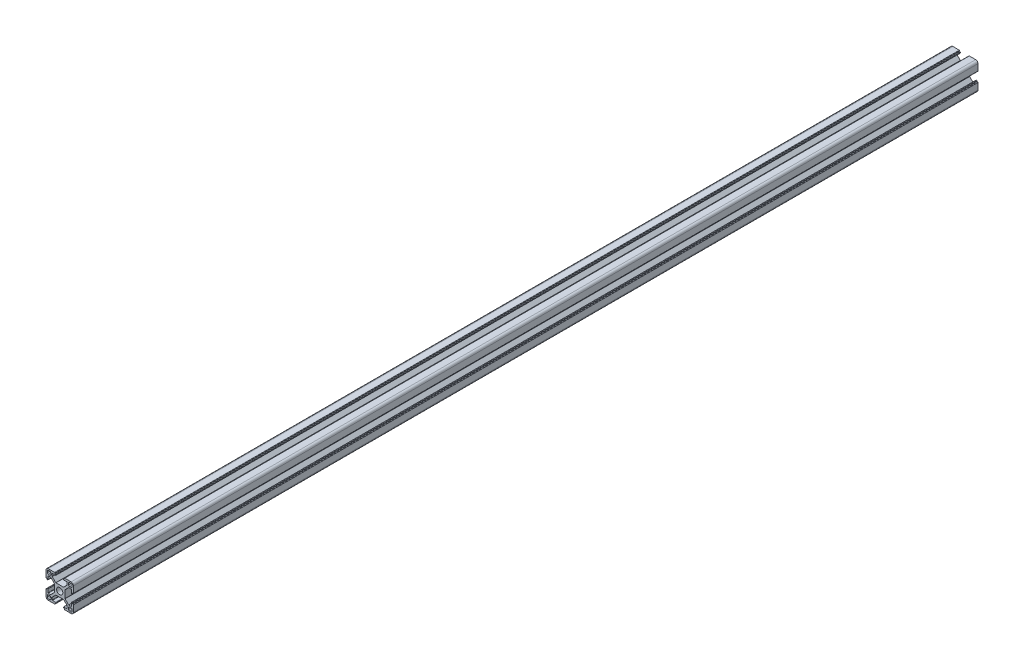
from build123d import *

# Parameters (mm, degrees)
MODEL_R             = 6.8
BOSS_EXTRUDE1_DEPTH = 1980
SCALE1_SCALE        = 0.333333333


with BuildPart() as part:
    # Model → Boss-Extrude1 (new body)
    with BuildSketch(Plane.XY):
        with BuildLine():
            Line((0, 11.6), (-8.240202025, 11.6))
            ThreePointArc((-8.240202025, 11.6), (-8.469812085, 11.64567228), (-8.664466094, 11.775735931))
            Line((-8.664466094, 11.775735931), (-16.324264069, 19.435533906))
            ThreePointArc((-16.324264069, 19.435533906), (-16.45432772, 19.630187915), (-16.5, 19.859797975))
            Line((-16.5, 19.859797975), (-16.5, 25))
            ThreePointArc((-16.5, 25), (-16.324264069, 25.424264069), (-15.9, 25.6))
            Line((-15.9, 25.6), (-8.8, 25.6))
            ThreePointArc((-8.8, 25.6), (-8.375735931, 25.775735931), (-8.2, 26.2))
            Line((-8.2, 26.2), (-8.2, 27.4))
            ThreePointArc((-8.2, 27.4), (-8.375735931, 27.824264069), (-8.8, 28))
            Line((-8.8, 28), (-9.8, 28))
            ThreePointArc((-9.8, 28), (-10.224264069, 28.175735931), (-10.4, 28.6))
            Line((-10.4, 28.6), (-10.4, 29.4))
            ThreePointArc((-10.4, 29.4), (-10.575735931, 29.824264069), (-10.999999999, 30))
            Line((-10.999999999, 30), (-25, 30))
            ThreePointArc((-25, 30), (-28.535533906, 28.535533906), (-30, 25))
            Line((-30, 25), (-30, 11))
            ThreePointArc((-30, 11), (-29.824264069, 10.575735931), (-29.4, 10.4))
            Line((-29.4, 10.4), (-28.6, 10.4))
            ThreePointArc((-28.6, 10.4), (-28.175735931, 10.224264069), (-28, 9.8))
            Line((-28, 9.8), (-28, 8.8))
            ThreePointArc((-28, 8.8), (-27.824264069, 8.375735931), (-27.4, 8.2))
            Line((-27.4, 8.2), (-26.2, 8.2))
            ThreePointArc((-26.2, 8.2), (-25.775735931, 8.375735931), (-25.6, 8.8))
            Line((-25.6, 8.8), (-25.6, 15.9))
            ThreePointArc((-25.6, 15.9), (-25.424264069, 16.324264069), (-25, 16.5))
            Line((-25, 16.5), (-19.859797974, 16.5))
            ThreePointArc((-19.859797974, 16.5), (-19.630187915, 16.454327719), (-19.435533906, 16.324264068))
            Line((-19.435533906, 16.324264068), (-11.775735931, 8.664466094))
            ThreePointArc((-11.775735931, 8.664466094), (-11.64567228, 8.469812085), (-11.6, 8.240202025))
            Line((-11.6, 8.240202025), (-11.6, 0))
            Line((-11.6, 0), (-11.6, -8.240202025))
            ThreePointArc((-11.6, -8.240202025), (-11.64567228, -8.469812085), (-11.775735931, -8.664466094))
            Line((-11.775735931, -8.664466094), (-19.435533906, -16.324264068))
            ThreePointArc((-19.435533906, -16.324264068), (-19.630187915, -16.454327719), (-19.859797974, -16.5))
            Line((-19.859797974, -16.5), (-25, -16.5))
            ThreePointArc((-25, -16.5), (-25.424264069, -16.324264069), (-25.6, -15.9))
            Line((-25.6, -15.9), (-25.6, -8.8))
            ThreePointArc((-25.6, -8.8), (-25.775735931, -8.375735931), (-26.2, -8.2))
            Line((-26.2, -8.2), (-27.4, -8.2))
            ThreePointArc((-27.4, -8.2), (-27.824264069, -8.375735931), (-28, -8.8))
            Line((-28, -8.8), (-28, -9.8))
            ThreePointArc((-28, -9.8), (-28.175735931, -10.224264069), (-28.6, -10.4))
            Line((-28.6, -10.4), (-29.4, -10.4))
            ThreePointArc((-29.4, -10.4), (-29.824264069, -10.575735931), (-30, -11))
            Line((-30, -11), (-30, -25))
            ThreePointArc((-30, -25), (-28.535533906, -28.535533906), (-25, -30))
            Line((-25, -30), (-10.999999999, -30))
            ThreePointArc((-10.999999999, -30), (-10.575735931, -29.824264069), (-10.4, -29.4))
            Line((-10.4, -29.4), (-10.4, -28.6))
            ThreePointArc((-10.4, -28.6), (-10.224264069, -28.175735931), (-9.8, -28))
            Line((-9.8, -28), (-8.8, -28))
            ThreePointArc((-8.8, -28), (-8.375735931, -27.824264069), (-8.2, -27.4))
            Line((-8.2, -27.4), (-8.2, -26.2))
            ThreePointArc((-8.2, -26.2), (-8.375735931, -25.775735931), (-8.8, -25.6))
            Line((-8.8, -25.6), (-15.9, -25.6))
            ThreePointArc((-15.9, -25.6), (-16.324264069, -25.424264069), (-16.5, -25))
            Line((-16.5, -25), (-16.5, -19.859797975))
            ThreePointArc((-16.5, -19.859797975), (-16.45432772, -19.630187915), (-16.324264069, -19.435533906))
            Line((-16.324264069, -19.435533906), (-8.664466094, -11.775735931))
            ThreePointArc((-8.664466094, -11.775735931), (-8.469812085, -11.64567228), (-8.240202025, -11.6))
            Line((-8.240202025, -11.6), (0, -11.6))
            Line((0, -11.6), (8.240202025, -11.6))
            ThreePointArc((8.240202025, -11.6), (8.469812085, -11.64567228), (8.664466094, -11.775735931))
            Line((8.664466094, -11.775735931), (16.324264069, -19.435533906))
            ThreePointArc((16.324264069, -19.435533906), (16.45432772, -19.630187915), (16.5, -19.859797975))
            Line((16.5, -19.859797975), (16.5, -25))
            ThreePointArc((16.5, -25), (16.324264069, -25.424264069), (15.9, -25.6))
            Line((15.9, -25.6), (8.8, -25.6))
            ThreePointArc((8.8, -25.6), (8.375735931, -25.775735931), (8.2, -26.2))
            Line((8.2, -26.2), (8.2, -27.4))
            ThreePointArc((8.2, -27.4), (8.375735931, -27.824264069), (8.8, -28))
            Line((8.8, -28), (9.8, -28))
            ThreePointArc((9.8, -28), (10.224264069, -28.175735931), (10.4, -28.6))
            Line((10.4, -28.6), (10.4, -29.4))
            ThreePointArc((10.4, -29.4), (10.575735931, -29.824264069), (10.999999999, -30))
            Line((10.999999999, -30), (25, -30))
            ThreePointArc((25, -30), (28.535533906, -28.535533906), (30, -25))
            Line((30, -25), (30, -11))
            ThreePointArc((30, -11), (29.824264069, -10.575735931), (29.4, -10.4))
            Line((29.4, -10.4), (28.6, -10.4))
            ThreePointArc((28.6, -10.4), (28.175735931, -10.224264069), (28, -9.8))
            Line((28, -9.8), (28, -8.8))
            ThreePointArc((28, -8.8), (27.824264069, -8.375735931), (27.4, -8.2))
            Line((27.4, -8.2), (26.2, -8.2))
            ThreePointArc((26.2, -8.2), (25.775735931, -8.375735931), (25.6, -8.8))
            Line((25.6, -8.8), (25.6, -15.9))
            ThreePointArc((25.6, -15.9), (25.424264069, -16.324264069), (25, -16.5))
            Line((25, -16.5), (19.859797974, -16.5))
            ThreePointArc((19.859797974, -16.5), (19.630187915, -16.454327719), (19.435533906, -16.324264068))
            Line((19.435533906, -16.324264068), (11.775735931, -8.664466094))
            ThreePointArc((11.775735931, -8.664466094), (11.64567228, -8.469812085), (11.6, -8.240202025))
            Line((11.6, -8.240202025), (11.6, 0))
            Line((11.6, 0), (11.6, 8.240202025))
            ThreePointArc((11.6, 8.240202025), (11.64567228, 8.469812085), (11.775735931, 8.664466094))
            Line((11.775735931, 8.664466094), (19.611269837, 16.5))
            Line((19.611269837, 16.5), (25, 16.5))
            ThreePointArc((25, 16.5), (25.424264069, 16.324264069), (25.6, 15.9))
            Line((25.6, 15.9), (25.6, 8.8))
            ThreePointArc((25.6, 8.8), (25.775735931, 8.375735931), (26.2, 8.2))
            Line((26.2, 8.2), (27.4, 8.2))
            ThreePointArc((27.4, 8.2), (27.824264069, 8.375735931), (28, 8.8))
            Line((28, 8.8), (28, 9.8))
            ThreePointArc((28, 9.8), (28.175735931, 10.224264069), (28.6, 10.4))
            Line((28.6, 10.4), (29.4, 10.4))
            ThreePointArc((29.4, 10.4), (29.824264069, 10.575735931), (30, 11))
            Line((30, 11), (30, 25))
            ThreePointArc((30, 25), (28.535533906, 28.535533906), (25, 30))
            Line((25, 30), (10.999999999, 30))
            ThreePointArc((10.999999999, 30), (10.575735931, 29.824264069), (10.4, 29.4))
            Line((10.4, 29.4), (10.4, 28.6))
            ThreePointArc((10.4, 28.6), (10.224264069, 28.175735931), (9.8, 28))
            Line((9.8, 28), (8.8, 28))
            ThreePointArc((8.8, 28), (8.375735931, 27.824264069), (8.2, 27.4))
            Line((8.2, 27.4), (8.2, 26.2))
            ThreePointArc((8.2, 26.2), (8.375735931, 25.775735931), (8.8, 25.6))
            Line((8.8, 25.6), (15.9, 25.6))
            ThreePointArc((15.9, 25.6), (16.324264069, 25.424264069), (16.5, 25))
            Line((16.5, 25), (16.5, 19.859797975))
            ThreePointArc((16.5, 19.859797975), (16.45432772, 19.630187915), (16.324264069, 19.435533906))
            Line((16.324264069, 19.435533906), (8.664466094, 11.775735931))
            ThreePointArc((8.664466094, 11.775735931), (8.469812085, 11.64567228), (8.240202025, 11.6))
            Line((8.240202025, 11.6), (0, 11.6))
        make_face()
        Circle(MODEL_R, mode=Mode.SUBTRACT)
        with BuildLine():
            Line((21.5, 27), (25, 27))
            ThreePointArc((25, 27), (26.414213562, 26.414213562), (27, 25))
            Line((27, 25), (27, 21.5))
            ThreePointArc((27, 21.5), (26.414213562, 20.085786438), (25, 19.5))
            Line((25, 19.5), (21.5, 19.5))
            ThreePointArc((21.5, 19.5), (20.085786438, 20.085786438), (19.5, 21.5))
            Line((19.5, 21.5), (19.5, 25))
            ThreePointArc((19.5, 25), (20.085786438, 26.414213562), (21.5, 27))
        make_face(mode=Mode.SUBTRACT)
        with BuildLine():
            Line((21.5, -27), (25, -27))
            ThreePointArc((25, -27), (26.414213562, -26.414213562), (27, -25))
            Line((27, -25), (27, -21.5))
            ThreePointArc((27, -21.5), (26.414213562, -20.085786438), (25, -19.5))
            Line((25, -19.5), (21.5, -19.5))
            ThreePointArc((21.5, -19.5), (20.085786438, -20.085786438), (19.5, -21.5))
            Line((19.5, -21.5), (19.5, -25))
            ThreePointArc((19.5, -25), (20.085786438, -26.414213562), (21.5, -27))
        make_face(mode=Mode.SUBTRACT)
        with BuildLine():
            Line((-21.5, -27), (-25, -27))
            ThreePointArc((-25, -27), (-26.414213562, -26.414213562), (-27, -25))
            Line((-27, -25), (-27, -21.5))
            ThreePointArc((-27, -21.5), (-26.414213562, -20.085786438), (-25, -19.5))
            Line((-25, -19.5), (-21.5, -19.5))
            ThreePointArc((-21.5, -19.5), (-20.085786438, -20.085786438), (-19.5, -21.5))
            Line((-19.5, -21.5), (-19.5, -25))
            ThreePointArc((-19.5, -25), (-20.085786438, -26.414213562), (-21.5, -27))
        make_face(mode=Mode.SUBTRACT)
        with BuildLine():
            Line((-21.5, 27), (-25, 27))
            ThreePointArc((-25, 27), (-26.414213562, 26.414213562), (-27, 25))
            Line((-27, 25), (-27, 21.5))
            ThreePointArc((-27, 21.5), (-26.414213562, 20.085786438), (-25, 19.5))
            Line((-25, 19.5), (-21.5, 19.5))
            ThreePointArc((-21.5, 19.5), (-20.085786438, 20.085786438), (-19.5, 21.5))
            Line((-19.5, 21.5), (-19.5, 25))
            ThreePointArc((-19.5, 25), (-20.085786438, 26.414213562), (-21.5, 27))
        make_face(mode=Mode.SUBTRACT)
    extrude(amount=BOSS_EXTRUDE1_DEPTH)


with BuildPart() as part_1:
    # Scale1: scaled about (-0.000116359, -9.761e-05, 990)
    add(part.part.scale(SCALE1_SCALE).moved(Location((-7.7573e-05, -6.5073e-05, 660))))


solid = part_1.part
